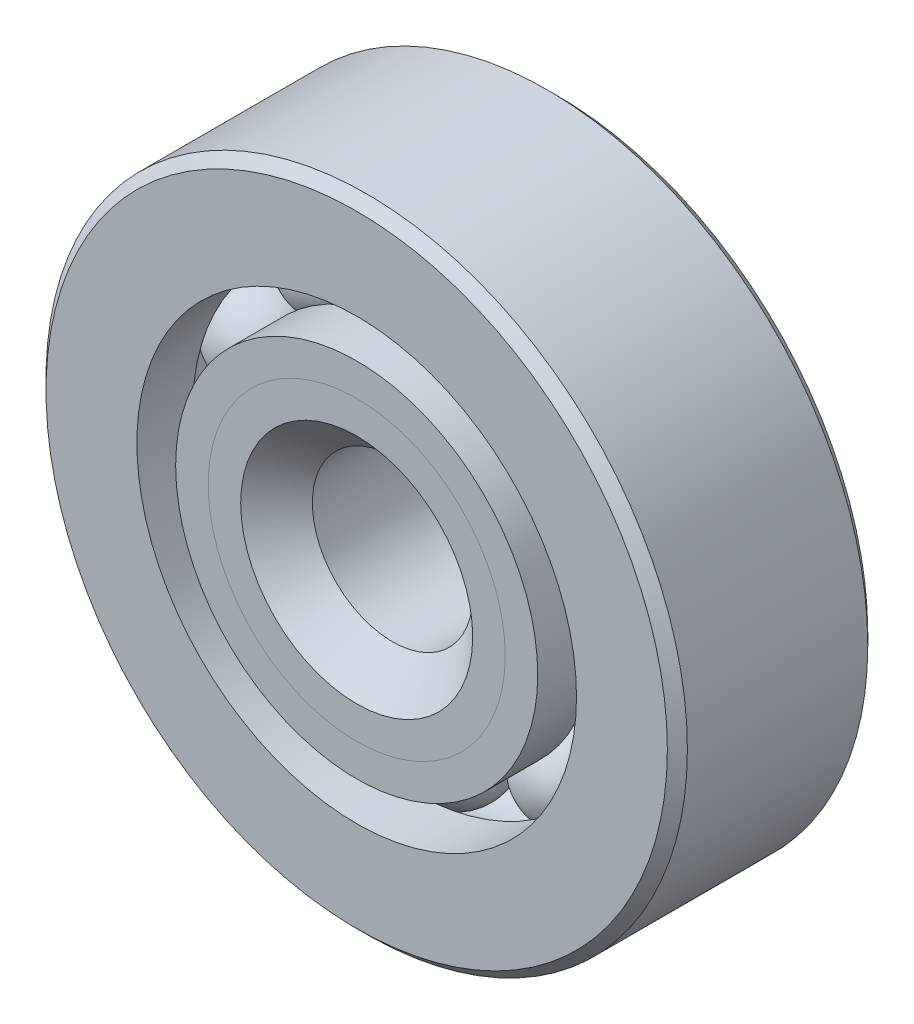
from build123d import *

# Parameters (mm, degrees)
CIRPATTERN1_COUNT = 10


with BuildPart() as part:
    # Sketch1 → Revolve1 (revolve)
    with BuildSketch(Plane(origin=(0, 0, 0), x_dir=(0, 0, -1), z_dir=(1, 0, 0))):
        with BuildLine():
            Line((1.7859375, 6.35), (-1.7859375, 6.35))
            Line((-1.7859375, 6.35), (-1.984375, 6.1515625))
            Line((-1.984375, 6.1515625), (-1.984375, 4.352541209))
            Line((-1.984375, 4.352541209), (-0.881944444, 4.352541209))
            ThreePointArc((-0.881944444, 4.352541209), (0, 4.930582467), (0.881944444, 4.352541209))
            Line((0.881944444, 4.352541209), (1.984375, 4.352541209))
            Line((1.984375, 4.352541209), (1.984375, 6.1515625))
            Line((1.984375, 6.1515625), (1.7859375, 6.35))
        make_face()
    revolve(axis=Axis((0, 0, 1.984375), (0, 0, -1)))


with BuildPart() as body_2:
    # Sketch2 → Revolve2 (revolve)
    with BuildSketch(Plane(origin=(0, 0, 0), x_dir=(0, 0, -1), z_dir=(1, 0, 0))):
        with BuildLine():
            Line((-1.984375, 3.584958791), (-0.881944444, 3.584958791))
            ThreePointArc((-0.881944444, 3.584958791), (-0.527247025, 3.164304682), (0, 3.006917533))
            Line((0, 3.006917533), (0, 2.297208766))
            Line((0, 2.297208766), (-1.340499988, 2.297208766))
            Line((-1.340499988, 2.297208766), (-1.984375, 2.941083779))
            Line((-1.984375, 2.941083779), (-1.984375, 3.584958791))
        make_face()
    revolve(axis=Axis((0, 0, 1.984375), (0, 0, -1)))


with BuildPart() as body_3:
    # Sketch3 → Revolve3 (revolve)
    with BuildSketch(Plane(origin=(0, 0, 0), x_dir=(0, 0, -1), z_dir=(1, 0, 0))):
        with BuildLine():
            Line((-1.984375, 2.941083779), (-1.340499988, 2.297208766))
            Line((-1.340499988, 2.297208766), (0, 2.297208766))
            Line((0, 2.297208766), (0, 3.006917533))
            ThreePointArc((0, 3.006917533), (0.527247025, 3.164304682), (0.881944444, 3.584958791))
            Line((0.881944444, 3.584958791), (1.984375, 3.584958791))
            Line((1.984375, 3.584958791), (1.984375, 1.7859375))
            Line((1.984375, 1.7859375), (1.7859375, 1.5875))
            Line((1.7859375, 1.5875), (-1.274666234, 1.5875))
            Line((-1.274666234, 1.5875), (-1.984375, 2.297208766))
            Line((-1.984375, 2.297208766), (-1.984375, 2.941083779))
        make_face()
    revolve(axis=Axis((0, 0, 1.984375), (0, 0, -1)))


with BuildPart() as body_4:
    # Sketch4 → Revolve4 (revolve)
    with BuildSketch(Plane(origin=(0, 0, 0), x_dir=(0, 0, -1), z_dir=(1, 0, 0))):
        with BuildLine():
            Line((-0.961832467, 3.96875), (0.961832467, 3.96875))
            ThreePointArc((0.961832467, 3.96875), (0, 4.930582467), (-0.961832467, 3.96875))
        make_face()
    revolve(axis=Axis((0, 3.96875, 0.961832467), (0, 0, -1)))


with BuildPart() as cirpattern1_1:
    # CirPattern1: pattern copy
    add(body_4.part.rotate(Axis((0, 0, -1.984375), (0, 0, 1)), 1 * 360 / CIRPATTERN1_COUNT))


with BuildPart() as cirpattern1_2:
    # CirPattern1: pattern copy
    add(body_4.part.rotate(Axis((0, 0, -1.984375), (0, 0, 1)), 2 * 360 / CIRPATTERN1_COUNT))


with BuildPart() as cirpattern1_3:
    # CirPattern1: pattern copy
    add(body_4.part.rotate(Axis((0, 0, -1.984375), (0, 0, 1)), 3 * 360 / CIRPATTERN1_COUNT))


with BuildPart() as cirpattern1_4:
    # CirPattern1: pattern copy
    add(body_4.part.rotate(Axis((0, 0, -1.984375), (0, 0, 1)), 4 * 360 / CIRPATTERN1_COUNT))


with BuildPart() as cirpattern1_5:
    # CirPattern1: pattern copy
    add(body_4.part.rotate(Axis((0, 0, -1.984375), (0, 0, 1)), 5 * 360 / CIRPATTERN1_COUNT))


with BuildPart() as cirpattern1_6:
    # CirPattern1: pattern copy
    add(body_4.part.rotate(Axis((0, 0, -1.984375), (0, 0, 1)), 6 * 360 / CIRPATTERN1_COUNT))


with BuildPart() as cirpattern1_7:
    # CirPattern1: pattern copy
    add(body_4.part.rotate(Axis((0, 0, -1.984375), (0, 0, 1)), 7 * 360 / CIRPATTERN1_COUNT))


with BuildPart() as cirpattern1_8:
    # CirPattern1: pattern copy
    add(body_4.part.rotate(Axis((0, 0, -1.984375), (0, 0, 1)), 8 * 360 / CIRPATTERN1_COUNT))


with BuildPart() as cirpattern1_9:
    # CirPattern1: pattern copy
    add(body_4.part.rotate(Axis((0, 0, -1.984375), (0, 0, 1)), 9 * 360 / CIRPATTERN1_COUNT))


solid = Compound([part.part, body_2.part, body_3.part, body_4.part, cirpattern1_1.part, cirpattern1_2.part, cirpattern1_3.part, cirpattern1_4.part, cirpattern1_5.part, cirpattern1_6.part, cirpattern1_7.part, cirpattern1_8.part, cirpattern1_9.part])
